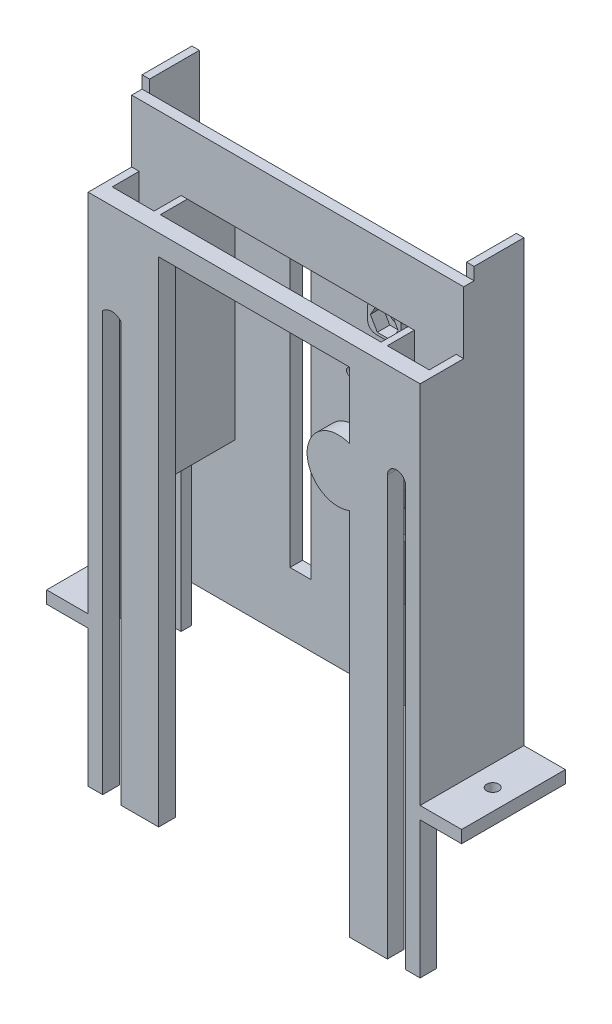
from build123d import *

# Parameters (mm, degrees)
SKETCH1_W            = 9.1
SKETCH1_H            = 51
SKETCH1_W_2          = 23
SKETCH1_H_2          = 5
BOSS_EXTRUDE1_DEPTH  = 4
SKETCH2_W            = 1.8
SKETCH2_H            = 56
SKETCH2_W_2          = 1.5
BOSS_EXTRUDE2_DEPTH  = 5
SKETCH3_W            = 1.5
SKETCH3_H            = 30
CUT_EXTRUDE1_DEPTH   = 5
SKETCH4_W            = 1.8
SKETCH4_H            = 13
SKETCH4_W_2          = 1.5
SKETCH4_H_2          = 3
SKETCH4_W_3          = 10.1
SKETCH4_W_4          = 53.2
BOSS_EXTRUDE3_DEPTH  = 56
SKETCH5_R            = 1.75
SKETCH5_R_2          = 4.75
CUT_EXTRUDE2_DEPTH   = 3
SKETCH6_W            = 8
SKETCH6_H            = 7
BOSS_EXTRUDE4_DEPTH  = 3
FILLET1_R            = 2
SKETCH7_W            = 1.5
SKETCH7_H            = 30
CUT_EXTRUDE3_DEPTH   = 7
SKETCH8_W            = 5
SKETCH8_H            = 50
CUT_EXTRUDE4_DEPTH   = 3
SKETCH11_W           = 7
SKETCH11_H           = 3
BOSS_EXTRUDE5_DEPTH  = 10
SKETCH12_W           = 25
SKETCH12_H           = 3
BOSS_EXTRUDE6_DEPTH  = 10
SKETCH13_W           = 25
SKETCH13_H           = 3
BOSS_EXTRUDE7_DEPTH  = 10
SKETCH14_R           = 1.75
CUT_EXTRUDE6_DEPTH   = 3
BOSS_EXTRUDE8_START  = -4
BOSS_EXTRUDE8_DEPTH  = 4
SKETCH17_W           = 3.4
SKETCH17_H           = 32.199052503
CUT_EXTRUDE8_DEPTH   = 4
SKETCH18_W           = 23
SKETCH18_H           = 12
CUT_EXTRUDE9_DEPTH   = 10
SKETCH19_W           = 76.4
SKETCH19_H           = 18
BOSS_EXTRUDE10_DEPTH = 35
SKETCH21_R           = 1.45
CUT_EXTRUDE11_DEPTH  = 109.360509412
SKETCH20_W           = 10
SKETCH20_H           = 25
SKETCH20_W_2         = 7
SKETCH20_H_2         = 10
CUT_EXTRUDE10_DEPTH  = 35
SKETCH22_W           = 4.4
SKETCH22_H           = 35
CUT_EXTRUDE12_DEPTH  = 10
SKETCH23_W           = 46
SKETCH23_H           = 35
CUT_EXTRUDE13_DEPTH  = 10
SKETCH25_W           = 1.8
SKETCH25_H           = 12
BOSS_EXTRUDE12_DEPTH = 18
SKETCH27_R           = 1
CUT_EXTRUDE15_DEPTH  = 5
SKETCH28_W           = 7
SKETCH28_H           = 10
CUT_EXTRUDE16_DEPTH  = 122.231184107
SKETCH29_W           = 7
SKETCH29_H           = 10
BOSS_EXTRUDE13_DEPTH = 2
SKETCH30_R           = 1.5
CUT_EXTRUDE17_DEPTH  = 109.360509412
BOSS_EXTRUDE14_DEPTH = 4
SKETCH33_W           = 3.5
SKETCH33_H           = 4
SKETCH33_W_2         = 9.1
BOSS_EXTRUDE15_DEPTH = 33
BOSS_EXTRUDE16_DEPTH = 4
SKETCH35_W           = 80
SKETCH35_H           = 15
BOSS_EXTRUDE17_DEPTH = 2.5
SKETCH36_W           = 10.1
SKETCH36_H           = 2.5
BOSS_EXTRUDE18_DEPTH = 91
SKETCH37_W           = 5
SKETCH37_H           = 20
CUT_EXTRUDE18_DEPTH  = 5


with BuildPart() as part:
    # Sketch1 → Boss-Extrude1 (new body)
    with BuildSketch(Plane.XY):
        with BuildLine():
            Line((-23, 23), (-23, 28))
            Line((-23, 28), (-40, 28))
            Line((-40, 28), (-40, -28))
            Line((-40, -28), (-36.5, -28))
            Line((-36.5, -28), (-36.5, 23))
            ThreePointArc((-36.5, 23), (-34.3, 25.2), (-32.1, 23))
            Line((-32.1, 23), (-23, 23))
        make_face()
        with Locations((-27.55, -2.5)):
            Rectangle(SKETCH1_W, SKETCH1_H)
        with Locations((-11.5, 25.5)):
            Rectangle(SKETCH1_W_2, SKETCH1_H_2)
        with Locations((27.55, -2.5)):
            Rectangle(SKETCH1_W, SKETCH1_H)
        with Locations((11.5, 25.5)):
            Rectangle(SKETCH1_W_2, SKETCH1_H_2)
        with BuildLine():
            Line((40, 28), (23, 28))
            Line((23, 28), (23, 23))
            Line((23, 23), (32.1, 23))
            ThreePointArc((32.1, 23), (34.3, 25.2), (36.5, 23))
            Line((36.5, 23), (36.5, -28))
            Line((36.5, -28), (40, -28))
            Line((40, -28), (40, 28))
        make_face()
    extrude(amount=BOSS_EXTRUDE1_DEPTH)

    # Sketch2 → Boss-Extrude2 (add)
    with BuildSketch(Plane(origin=(0, 0, 0), x_dir=(-1, 0, 0), z_dir=(0, 0, -1))):
        with Locations((-39.1, 0)):
            Rectangle(SKETCH2_W, SKETCH2_H)
        with Locations((-27.35, 0)):
            Rectangle(SKETCH2_W_2, SKETCH2_H)
        with Locations((27.35, 0)):
            Rectangle(SKETCH2_W_2, SKETCH2_H)
        with Locations((39.1, 0)):
            Rectangle(SKETCH2_W, SKETCH2_H)
    extrude(amount=BOSS_EXTRUDE2_DEPTH)

    # Sketch3 → Cut-Extrude1 (cut)
    with BuildSketch(Plane(origin=(0, 0, -5), x_dir=(-1, 0, 0), z_dir=(0, 0, -1))):
        with Locations((-27.35, 0)):
            Rectangle(SKETCH3_W, SKETCH3_H)
    extrude(amount=-CUT_EXTRUDE1_DEPTH, mode=Mode.SUBTRACT)

    # Sketch4 → Boss-Extrude3 (add)
    with BuildSketch(Plane(origin=(0, 28, 0), x_dir=(1, 0, 0), z_dir=(0, 1, 0))):
        with Locations((-39.1, 11.5)):
            Rectangle(SKETCH4_W, SKETCH4_H)
        with Locations((-27.35, 11.5)):
            Rectangle(SKETCH4_W_2, SKETCH4_H)
        with Locations((-27.35, 19.5)):
            Rectangle(SKETCH4_W_2, SKETCH4_H_2)
        with Locations((-33.15, 19.5)):
            Rectangle(SKETCH4_W_3, SKETCH4_H_2)
        with Locations((-39.1, 19.5)):
            Rectangle(SKETCH4_W, SKETCH4_H_2)
        with Locations((0, 19.5)):
            Rectangle(SKETCH4_W_4, SKETCH4_H_2)
        with Locations((27.35, 11.5)):
            Rectangle(SKETCH4_W_2, SKETCH4_H)
        with Locations((27.35, 19.5)):
            Rectangle(SKETCH4_W_2, SKETCH4_H_2)
        with Locations((33.15, 19.5)):
            Rectangle(SKETCH4_W_3, SKETCH4_H_2)
        with Locations((39.1, 19.5)):
            Rectangle(SKETCH4_W, SKETCH4_H_2)
        with Locations((39.1, 11.5)):
            Rectangle(SKETCH4_W, SKETCH4_H)
    extrude(amount=-BOSS_EXTRUDE3_DEPTH)

    # Sketch5 → Cut-Extrude2 (cut)
    with BuildSketch(Plane(origin=(0, 0, -21), x_dir=(-1, 0, 0), z_dir=(0, 0, -1))):
        with Locations((-12.36, 17.5)):
            Circle(SKETCH5_R)
        with Locations((-12.36, -17.5)):
            Circle(SKETCH5_R)
        with Locations((-20.26, 0)):
            Circle(SKETCH5_R_2)
    extrude(amount=-CUT_EXTRUDE2_DEPTH, mode=Mode.SUBTRACT)

    # Sketch6 → Boss-Extrude4 (add)
    # profile 1 of 2: a face of its own
    with BuildSketch(Plane.XY.offset(-18)):
        with Locations((12.36, 17.5)):
            Rectangle(SKETCH6_W, SKETCH6_H)
        Polygon((10.685684219, 14.6), (14.034315781, 14.6), (15.708631561, 17.5), (14.034315781, 20.4), (10.685684219, 20.4), (9.011368439, 17.5), align=None, mode=Mode.SUBTRACT)
    # profile 2 of 2: a face of its own
    with BuildSketch(Plane.XY.offset(-18)):
        with Locations((12.36, -17.5)):
            Rectangle(SKETCH6_W, SKETCH6_H)
        Polygon((10.685684219, -20.4), (14.034315781, -20.4), (15.708631561, -17.5), (14.034315781, -14.6), (10.685684219, -14.6), (9.011368439, -17.5), align=None, mode=Mode.SUBTRACT)
    extrude(amount=BOSS_EXTRUDE4_DEPTH)

    # Fillet1
    fillet1_edges = [part.edges().sort_by_distance(p)[0] for p in [
        (16.36, 14, -16.5),
        (16.36, 21, -16.5),
        (8.36, 21, -16.5),
        (8.36, 14, -16.5),
        (16.36, -21, -16.5),
        (16.36, -14, -16.5),
        (8.36, -14, -16.5),
        (8.36, -21, -16.5),
    ]]
    fillet(fillet1_edges, radius=FILLET1_R)

    # Sketch7 → Cut-Extrude3 (cut)
    with BuildSketch(Plane.XY.offset(-5)):
        with Locations((27.35, 0)):
            Rectangle(SKETCH7_W, SKETCH7_H)
    extrude(amount=-CUT_EXTRUDE3_DEPTH, mode=Mode.SUBTRACT)

    # Sketch8 → Cut-Extrude4 (cut)
    with BuildSketch(Plane(origin=(0, 0, -21), x_dir=(-1, 0, 0), z_dir=(0, 0, -1))):
        with Locations((10.85, -3)):
            Rectangle(SKETCH8_W, SKETCH8_H)
        with BuildLine():
            ThreePointArc((8.35, 22), (10.85, 24.5), (13.35, 22))
            Line((13.35, 22), (8.35, 22))
        make_face()
    extrude(amount=-CUT_EXTRUDE4_DEPTH, mode=Mode.SUBTRACT)

    # Sketch11 → Boss-Extrude5 (add)
    with BuildSketch(Plane(origin=(0, 0, -21), x_dir=(-1, 0, 0), z_dir=(0, 0, -1))):
        with Locations((-20.5, -26.5)):
            Rectangle(SKETCH11_W, SKETCH11_H)
        with Locations((20.5, -26.5)):
            Rectangle(SKETCH11_W, SKETCH11_H)
    extrude(amount=BOSS_EXTRUDE5_DEPTH)

    # Sketch12 → Boss-Extrude6 (add)
    with BuildSketch(Plane(origin=(40, 0, 0), x_dir=(0, 0, -1), z_dir=(1, 0, 0))):
        with Locations((8.5, -26.5)):
            Rectangle(SKETCH12_W, SKETCH12_H)
    extrude(amount=BOSS_EXTRUDE6_DEPTH)

    # Sketch13 → Boss-Extrude7 (add)
    with BuildSketch(Plane.ZY.offset(40)):
        with Locations((-8.5, -26.5)):
            Rectangle(SKETCH13_W, SKETCH13_H)
    extrude(amount=BOSS_EXTRUDE7_DEPTH)

    # Sketch14 → Cut-Extrude6 (cut)
    with BuildSketch(Plane(origin=(0, -25, 0), x_dir=(1, 0, 0), z_dir=(0, 1, 0))):
        with Locations(Location((20.5, 26, 0), (0, 0, 180))):
            Circle(SKETCH14_R)
        with Locations(Location((45, 8.5, 0), (0, 0, 180))):
            Circle(SKETCH14_R)
        with Locations(Location((-20.5, 26, 0), (0, 0, 180))):
            Circle(SKETCH14_R)
        with Locations(Location((-45, 8.5, 0), (0, 0, 180))):
            Circle(SKETCH14_R)
    extrude(amount=-CUT_EXTRUDE6_DEPTH, mode=Mode.SUBTRACT)

    # Sketch15 → Boss-Extrude8 (add)
    with BuildSketch(Plane.XY.offset(4).offset(BOSS_EXTRUDE8_START)):
        with BuildLine():
            ThreePointArc((23, 3.880064432), (24.477671158, 2.184891302), (25.01, 0))
            ThreePointArc((25.01, 0), (24.477671158, -2.184891302), (23, -3.880064432))
            Line((23, -3.880064432), (23, -6.981575753))
            ThreePointArc((23, -6.981575753), (26.456773354, -4.224926035), (27.76, 0))
            ThreePointArc((27.76, 0), (26.456773354, 4.224926035), (23, 6.981575753))
            Line((23, 6.981575753), (23, 3.880064432))
        make_face()
        with BuildLine():
            ThreePointArc((23, -3.880064432), (15.51, 0), (23, 3.880064432))
            Line((23, 3.880064432), (23, 6.981575753))
            ThreePointArc((23, 6.981575753), (12.76, 0), (23, -6.981575753))
            Line((23, -6.981575753), (23, -3.880064432))
        make_face()
        with BuildLine():
            ThreePointArc((23, -3.880064432), (24.477671158, -2.184891302), (25.01, 0))
            ThreePointArc((25.01, 0), (24.477671158, 2.184891302), (23, 3.880064432))
            Line((23, 3.880064432), (23, -3.880064432))
        make_face()
        with BuildLine():
            Line((23, -3.880064432), (23, 3.880064432))
            ThreePointArc((23, 3.880064432), (15.51, 0), (23, -3.880064432))
        make_face()
    extrude(amount=BOSS_EXTRUDE8_DEPTH)

    # Sketch17 → Cut-Extrude8 (cut)
    with BuildSketch(Plane(origin=(0, 0, -21), x_dir=(-1, 0, 0), z_dir=(0, 0, -1))):
        with Locations((34.3, 6.900473748)):
            Rectangle(SKETCH17_W, SKETCH17_H)
        with Locations((-34.3, 6.900473748)):
            Rectangle(SKETCH17_W, SKETCH17_H)
    extrude(amount=-CUT_EXTRUDE8_DEPTH, mode=Mode.SUBTRACT)

    # Sketch18 → Cut-Extrude9 (cut)
    with BuildSketch(Plane(origin=(0, 0, -21), x_dir=(-1, 0, 0), z_dir=(0, 0, -1))):
        with Locations((-14.76, 0)):
            Rectangle(SKETCH18_W, SKETCH18_H)
    extrude(amount=-CUT_EXTRUDE9_DEPTH, mode=Mode.SUBTRACT)

    # Sketch19 → Boss-Extrude10 (add)
    with BuildSketch(Plane.XZ.offset(28)):
        Polygon((-50, 4), (-38.2, 4), (38.2, 4), (50, 4), (50, -21), (38.2, -21), (24, -21), (24, -31), (17, -31), (17, -21), (-17, -21), (-17, -31), (-24, -31), (-24, -21), (-38.2, -21), (-50, -21), align=None)
        with Locations((0, -9)):
            Rectangle(SKETCH19_W, SKETCH19_H, mode=Mode.SUBTRACT)
    extrude(amount=BOSS_EXTRUDE10_DEPTH)

    # Sketch21 → Cut-Extrude11 (cut, through all)
    with BuildSketch(Plane.XZ.offset(63)):
        with Locations(Location((45, -8.5, 0), (0, 0, 270))):
            Circle(SKETCH21_R)
        with Locations(Location((20.5, -26, 0), (0, 0, 270))):
            Circle(SKETCH21_R)
        with Locations(Location((-20.5, -26, 0), (0, 0, 270))):
            Circle(SKETCH21_R)
        with Locations(Location((-45, -8.5, 0), (0, 0, 270))):
            Circle(SKETCH21_R)
    extrude(amount=-CUT_EXTRUDE11_DEPTH, mode=Mode.SUBTRACT)

    # Sketch20 → Cut-Extrude10 (cut)
    with BuildSketch(Plane(origin=(0, -25, 0), x_dir=(1, 0, 0), z_dir=(0, 1, 0))):
        with Locations((-45, 8.5)):
            Rectangle(SKETCH20_W, SKETCH20_H)
        with Locations((45, 8.5)):
            Rectangle(SKETCH20_W, SKETCH20_H)
        with Locations((-20.5, 26)):
            Rectangle(SKETCH20_W_2, SKETCH20_H_2)
        with Locations((20.5, 26)):
            Rectangle(SKETCH20_W_2, SKETCH20_H_2)
    extrude(amount=-CUT_EXTRUDE10_DEPTH, mode=Mode.SUBTRACT)

    # Sketch22 → Cut-Extrude12 (cut)
    with BuildSketch(Plane.XY.offset(4)):
        with Locations((-34.3, -45.5)):
            Rectangle(SKETCH22_W, SKETCH22_H)
        with Locations((34.3, -45.5)):
            Rectangle(SKETCH22_W, SKETCH22_H)
    extrude(amount=-CUT_EXTRUDE12_DEPTH, mode=Mode.SUBTRACT)

    # Sketch23 → Cut-Extrude13 (cut)
    with BuildSketch(Plane.XY.offset(4)):
        with Locations((0, -45.5)):
            Rectangle(SKETCH23_W, SKETCH23_H)
    extrude(amount=-CUT_EXTRUDE13_DEPTH, mode=Mode.SUBTRACT)

    # Sketch25 → Boss-Extrude12 (add)
    with BuildSketch(Plane(origin=(0, 28, 0), x_dir=(1, 0, 0), z_dir=(0, 1, 0))):
        with Locations((39.1, 15)):
            Rectangle(SKETCH25_W, SKETCH25_H)
        with Locations((-39.1, 15)):
            Rectangle(SKETCH25_W, SKETCH25_H)
    extrude(amount=BOSS_EXTRUDE12_DEPTH)

    # Sketch27 → Cut-Extrude15 (cut)
    with BuildSketch(Plane(origin=(0, 0, -21), x_dir=(-1, 0, 0), z_dir=(0, 0, -1))):
        with Locations((-1.26, 0)):
            Circle(SKETCH27_R)
        with Locations((-28.56, 0)):
            Circle(SKETCH27_R)
    extrude(amount=-CUT_EXTRUDE15_DEPTH, mode=Mode.SUBTRACT)

    # Sketch28 → Cut-Extrude16 (cut, through all)
    with BuildSketch(Plane(origin=(0, -60, 0), x_dir=(1, 0, 0), z_dir=(0, 1, 0))):
        with Locations((20.5, 26)):
            Rectangle(SKETCH28_W, SKETCH28_H)
        with Locations((-20.5, 26)):
            Rectangle(SKETCH28_W, SKETCH28_H)
    extrude(amount=-CUT_EXTRUDE16_DEPTH, mode=Mode.SUBTRACT)

    # Sketch29 → Boss-Extrude13 (add)
    with BuildSketch(Plane(origin=(0, -63, 0), x_dir=(1, 0, 0), z_dir=(0, 1, 0))):
        with Locations((13.1, 26)):
            Rectangle(SKETCH29_W, SKETCH29_H)
        with Locations((-13.1, 26)):
            Rectangle(SKETCH29_W, SKETCH29_H)
    extrude(amount=BOSS_EXTRUDE13_DEPTH)

    # Sketch30 → Cut-Extrude17 (cut, through all)
    with BuildSketch(Plane(origin=(0, 28, 0), x_dir=(1, 0, 0), z_dir=(0, 1, 0))):
        with Locations(Location((13.1, 26.5, 0), (0, 0, 180))):
            Circle(SKETCH30_R)
        with Locations(Location((-13.1, 26.5, 0), (0, 0, 180))):
            Circle(SKETCH30_R)
    extrude(amount=-CUT_EXTRUDE17_DEPTH, mode=Mode.SUBTRACT)

    # Sketch32 → Boss-Extrude14 (add)
    with BuildSketch(Plane.XY.offset(4)):
        with BuildLine():
            Line((-38, 26), (-30, 26))
            Line((-30, 26), (-30, 5))
            Line((-30, 5), (-32.1, 5))
            ThreePointArc((-32.1, 5), (-34.3, 5.960392195), (-36.5, 5))
            Line((-36.5, 5), (-38, 5))
            Line((-38, 5), (-38, 26))
        make_face()
    extrude(amount=-BOSS_EXTRUDE14_DEPTH)

    # Sketch33 → Boss-Extrude15 (add)
    with BuildSketch(Plane.XZ.offset(63)):
        with Locations((38.25, 2)):
            Rectangle(SKETCH33_W, SKETCH33_H)
        with Locations((-38.25, 2)):
            Rectangle(SKETCH33_W, SKETCH33_H)
        with Locations((-27.55, 2)):
            Rectangle(SKETCH33_W_2, SKETCH33_H)
        with Locations((27.55, 2)):
            Rectangle(SKETCH33_W_2, SKETCH33_H)
    extrude(amount=BOSS_EXTRUDE15_DEPTH)

    # Sketch34 → Boss-Extrude16 (add)
    with BuildSketch(Plane.XY.offset(4)):
        with BuildLine():
            Line((30, 26), (38, 26))
            Line((38, 26), (38, 5))
            Line((38, 5), (36.5, 5))
            ThreePointArc((36.5, 5), (34.3, 7.2), (32.1, 5))
            Line((32.1, 5), (30, 5))
            Line((30, 5), (30, 26))
        make_face()
    extrude(amount=-BOSS_EXTRUDE16_DEPTH)

    # Sketch35 → Boss-Extrude17 (add)
    with BuildSketch(Plane.XY.offset(-9)):
        with Locations((0, 35.5)):
            Rectangle(SKETCH35_W, SKETCH35_H)
    extrude(amount=BOSS_EXTRUDE17_DEPTH)

    # Sketch36 → Boss-Extrude18 (add)
    with BuildSketch(Plane.XZ.offset(-28)):
        with Locations((-33.15, -7.75)):
            Rectangle(SKETCH36_W, SKETCH36_H)
        with Locations((33.15, -7.75)):
            Rectangle(SKETCH36_W, SKETCH36_H)
    extrude(amount=BOSS_EXTRUDE18_DEPTH)

    # Sketch37 → Cut-Extrude18 (cut)
    with BuildSketch(Plane(origin=(0, 0, -21), x_dir=(-1, 0, 0), z_dir=(0, 0, -1))):
        with Locations((10.85, -38)):
            Rectangle(SKETCH37_W, SKETCH37_H)
    extrude(amount=-CUT_EXTRUDE18_DEPTH, mode=Mode.SUBTRACT)


solid = part.part
